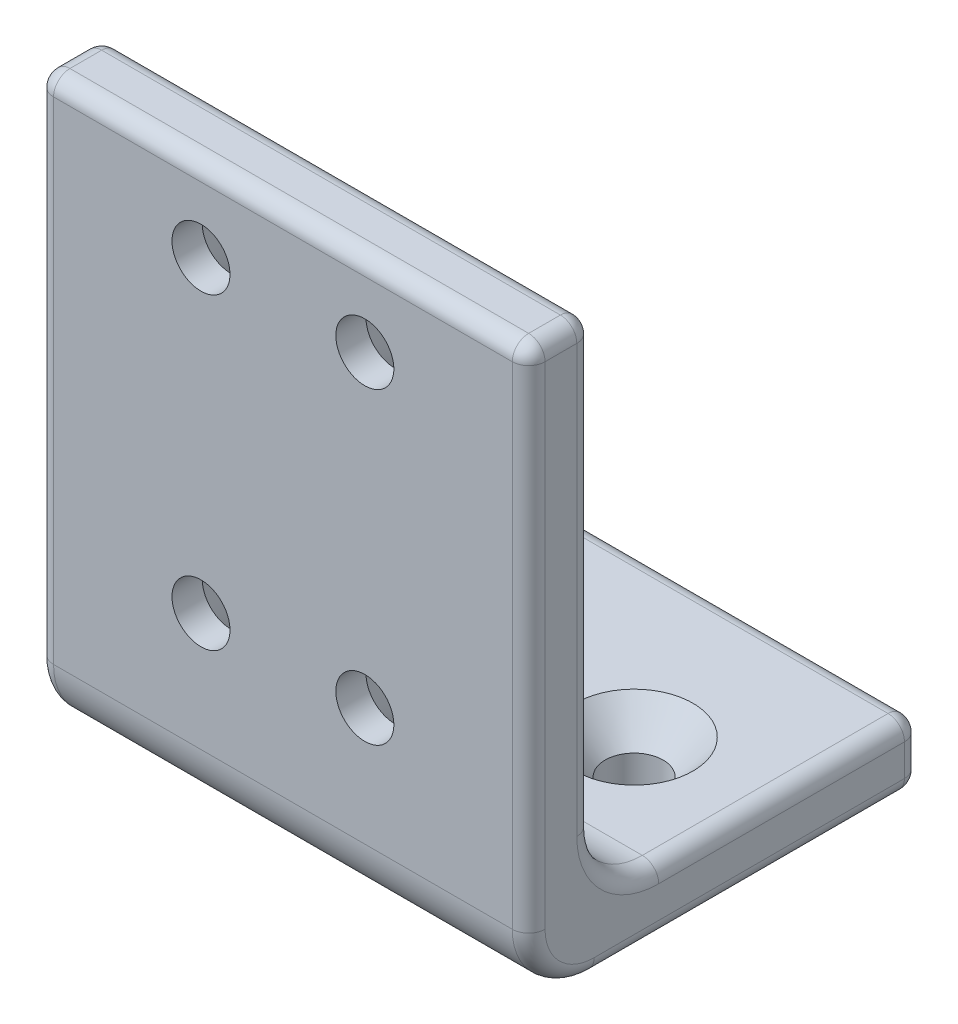
from build123d import *

# Parameters (mm, degrees)
SKETCH1_W                                     = 38.1
SKETCH1_H                                     = 44.45
BOSS_EXTRUDE1_DEPTH                           = 5
SKETCH2_W                                     = 38.1
SKETCH2_H                                     = 5
BOSS_EXTRUDE2_DEPTH                           = 25.4
CSK_FOR_8_FLAT_HEAD_SOCKET_CAP_SCREW1_A_COUNT = 2
CSK_FOR_8_FLAT_HEAD_SOCKET_CAP_SCREW1_A_PITCH = 12.7
CSK_FOR_8_FLAT_HEAD_SOCKET_CAP_SCRE_2_COUNT   = 2
CSK_FOR_8_FLAT_HEAD_SOCKET_CAP_SCRE_2_PITCH   = 27.043545921
CSK_FOR_8_FLAT_HEAD_SOCKET_CAP_SCRE_3_COUNT   = 2
CSK_FOR_8_FLAT_HEAD_SOCKET_CAP_SCRE_3_PITCH   = 23.876
CSK_FOR_8_FLAT_HEAD_SOCKET_CAP_SCREW2_A_COUNT = 2
CSK_FOR_8_FLAT_HEAD_SOCKET_CAP_SCREW2_A_PITCH = 19.05
FILLET1_R                                     = 5.08
FILLET2_R                                     = 5.08
FILLET3_R                                     = 1.27


with BuildPart() as part:
    # Sketch1 → Boss-Extrude1 (new body)
    with BuildSketch(Plane.XY):
        with Locations((19.05, 22.225)):
            Rectangle(SKETCH1_W, SKETCH1_H)
    extrude(amount=BOSS_EXTRUDE1_DEPTH)

    # Sketch2 → Boss-Extrude2 (add)
    with BuildSketch(Plane(origin=(0, 0, 0), x_dir=(-1, 0, 0), z_dir=(0, 0, -1))):
        with Locations((-19.05, 2.5)):
            Rectangle(SKETCH2_W, SKETCH2_H)
    extrude(amount=BOSS_EXTRUDE2_DEPTH)

    # Sketch4 → CSK for #8 Flat Head Socket Cap Screw1 (revolve, cut)
    with BuildSketch(Plane(origin=(25.4, 38.1, 0), x_dir=(0, 1, 0), z_dir=(1, 0, 0))):
        Polygon((0, 0), (0, 5), (2.2479, 5), (2.2479, 2.658961536), (4.5593, 0), align=None)
    csk_for_8_flat_head_socket_cap_screw1 = revolve(axis=Axis((25.4, 38.1, -6.35), (0, 0, 1)), mode=Mode.SUBTRACT)

    # CSK for #8 Flat Head Socket Cap Screw1 a: CSK for #8 Flat Head Socket Cap Screw1 ×2
    with Locations(*[(-i * CSK_FOR_8_FLAT_HEAD_SOCKET_CAP_SCREW1_A_PITCH, 0, 0) for i in range(1, CSK_FOR_8_FLAT_HEAD_SOCKET_CAP_SCREW1_A_COUNT)]):
        add(csk_for_8_flat_head_socket_cap_screw1, mode=Mode.SUBTRACT)

    # CSK for _8 Flat Head Socket Cap Scre 2: CSK for #8 Flat Head Socket Cap Screw1 ×2
    with Locations(*[Vector(-0.4696129729783402, -0.8828723891992799, 0) * (i * CSK_FOR_8_FLAT_HEAD_SOCKET_CAP_SCRE_2_PITCH) for i in range(1, CSK_FOR_8_FLAT_HEAD_SOCKET_CAP_SCRE_2_COUNT)]):
        add(csk_for_8_flat_head_socket_cap_screw1, mode=Mode.SUBTRACT)

    # CSK for _8 Flat Head Socket Cap Scre 3: CSK for #8 Flat Head Socket Cap Screw1 ×2
    with Locations(*[(0, -i * CSK_FOR_8_FLAT_HEAD_SOCKET_CAP_SCRE_3_PITCH, 0) for i in range(1, CSK_FOR_8_FLAT_HEAD_SOCKET_CAP_SCRE_3_COUNT)]):
        add(csk_for_8_flat_head_socket_cap_screw1, mode=Mode.SUBTRACT)

    # Sketch6 → CSK for #8 Flat Head Socket Cap Screw2 (revolve, cut)
    with BuildSketch(Plane(origin=(28.575, 5, -12.7), x_dir=(0, 0, 1), z_dir=(1, 0, 0))):
        Polygon((0, 0), (0, 5), (2.2479, 5), (2.2479, 2.658961536), (4.5593, 0), align=None)
    csk_for_8_flat_head_socket_cap_screw2 = revolve(axis=Axis((28.575, 11.35, -12.7), (0, -1, 0)), mode=Mode.SUBTRACT)

    # CSK for #8 Flat Head Socket Cap Screw2 a: CSK for #8 Flat Head Socket Cap Screw2 ×2
    with Locations(*[(-i * CSK_FOR_8_FLAT_HEAD_SOCKET_CAP_SCREW2_A_PITCH, 0, 0) for i in range(1, CSK_FOR_8_FLAT_HEAD_SOCKET_CAP_SCREW2_A_COUNT)]):
        add(csk_for_8_flat_head_socket_cap_screw2, mode=Mode.SUBTRACT)

    # Fillet1
    fillet1_edges = [part.edges().sort_by_distance(p)[0] for p in [
        (19.05, 5, 0),
    ]]
    fillet(fillet1_edges, radius=FILLET1_R)

    # Fillet2
    fillet2_edges = [part.edges().sort_by_distance(p)[0] for p in [
        (19.05, 0, 5),
    ]]
    fillet(fillet2_edges, radius=FILLET2_R)

    # Fillet3
    fillet3_edges = [part.edges().sort_by_distance(p)[0] for p in [
        (38.1, 24.765, 5),
        (38.1, 0, -12.74),
        (38.1, 1.487897552, 3.512102448),
        (0, 0, -12.74),
        (0, 1.487897552, 3.512102448),
        (38.1, 5, -15.24),
        (0, 5, -15.24),
        (38.1, 2.5, -25.4),
        (19.05, 44.45, 5),
        (19.05, 0, -25.4),
        (0, 2.5, -25.4),
        (19.05, 5, -25.4),
        (0, 24.765, 5),
        (19.05, 44.45, 0),
        (0, 27.265, 0),
        (38.1, 27.265, 0),
        (38.1, 6.487897552, -1.487897552),
        (0, 44.45, 2.5),
        (0, 6.487897552, -1.487897552),
        (38.1, 44.45, 2.5),
    ]]
    fillet(fillet3_edges, radius=FILLET3_R)


solid = part.part
